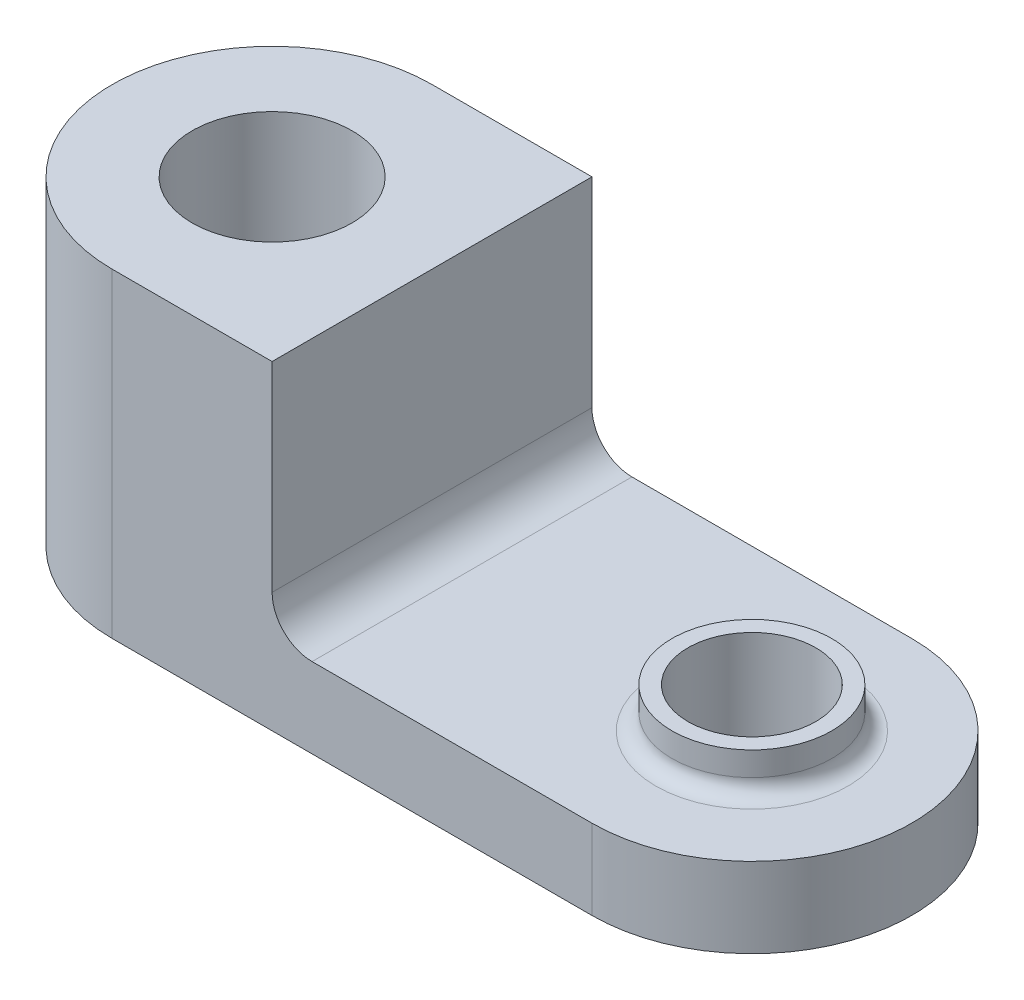
from build123d import *

# Parameters (mm, degrees)
SKETCH1_R           = 10
BOSS_EXTRUDE1_DEPTH = 10
SKETCH1_4_R         = 10
SKETCH1_4_R_2       = 8
BOSS_EXTRUDE2_DEPTH = 15
SKETCH1_5_R         = 10
BOSS_EXTRUDE3_DEPTH = 40
FILLET1_R           = 5
FILLET2_R           = 2


with BuildPart() as part:
    # Sketch1 → Boss-Extrude1 (new body)
    with BuildSketch(Plane(origin=(0, 0, 0), x_dir=(1, 0, 0), z_dir=(0, 1, 0))):
        with BuildLine():
            Line((60, 20), (20, 20))
            Line((20, 20), (20, -20))
            Line((20, -20), (60, -20))
            ThreePointArc((60, -20), (80, 0), (60, 20))
        make_face()
        with Locations((60, 0)):
            Circle(SKETCH1_R, mode=Mode.SUBTRACT)
    extrude(amount=BOSS_EXTRUDE1_DEPTH)

    # Sketch1<4> → Boss-Extrude2 (add)
    with BuildSketch(Plane(origin=(0, 0, 0), x_dir=(1, 0, 0), z_dir=(0, 1, 0))):
        with Locations((60, 0)):
            Circle(SKETCH1_4_R)
        with Locations((60, 0)):
            Circle(SKETCH1_4_R_2, mode=Mode.SUBTRACT)
    extrude(amount=BOSS_EXTRUDE2_DEPTH)

    # Sketch1<5> → Boss-Extrude3 (add)
    with BuildSketch(Plane(origin=(0, 0, 0), x_dir=(1, 0, 0), z_dir=(0, 1, 0))):
        with BuildLine():
            Line((20, 20), (0, 20))
            ThreePointArc((0, 20), (-20, 0), (0, -20))
            Line((0, -20), (20, -20))
            Line((20, -20), (20, 20))
        make_face()
        Circle(SKETCH1_5_R, mode=Mode.SUBTRACT)
    extrude(amount=BOSS_EXTRUDE3_DEPTH)

    # Fillet1
    fillet1_edges = [part.edges().sort_by_distance(p)[0] for p in [
        (20, 10, 0),
    ]]
    fillet(fillet1_edges, radius=FILLET1_R)

    # Fillet2
    fillet2_edges = [part.edges().sort_by_distance(p)[0] for p in [
        (50, 10, 0),
    ]]
    fillet(fillet2_edges, radius=FILLET2_R)


solid = part.part
